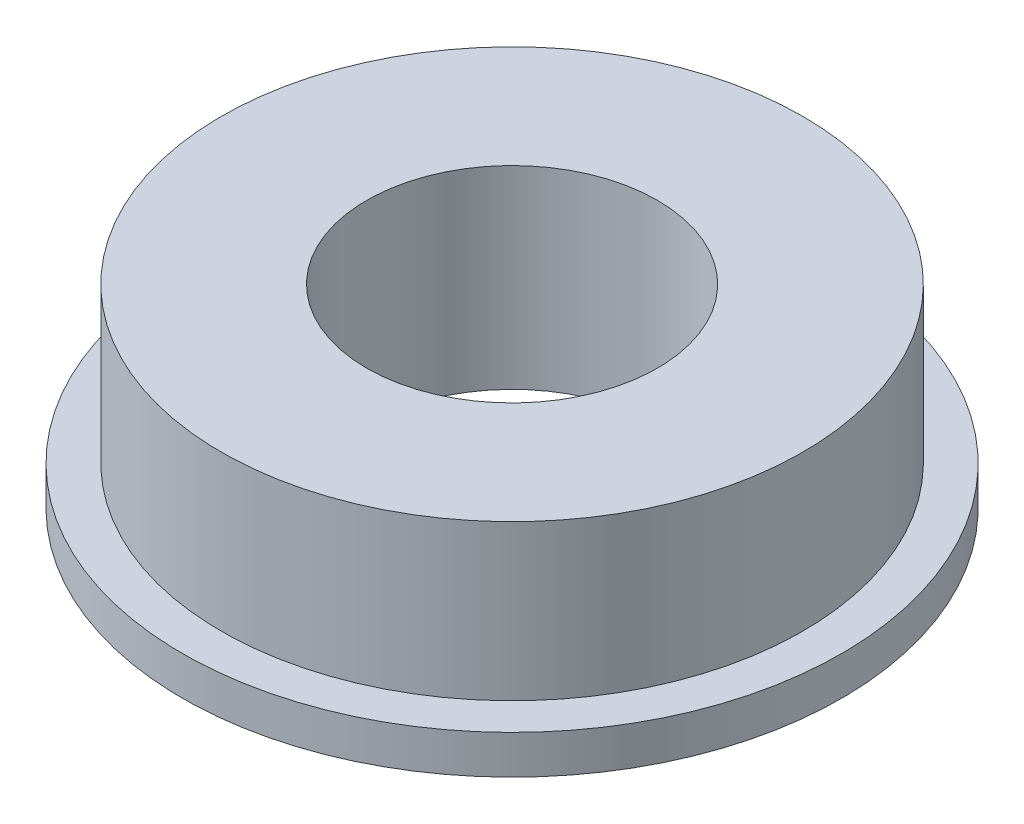
from build123d import *


with BuildPart() as part:
    # 草图1 → 旋转1 (revolve)
    with BuildSketch(Plane.XY, mode=Mode.PRIVATE) as revolve_1_sk:
        Polygon((-3, 4), (-3, 0), (-6.8, 0), (-6.8, 0.8), (-6, 0.8), (-6, 4), align=None)
    revolve(revolve_1_sk.sketch.rotate(Axis((0, 0, 0), (0, 1, 0)), 270), axis=Axis((0, 0, 0), (0, 1, 0)))


solid = part.part
